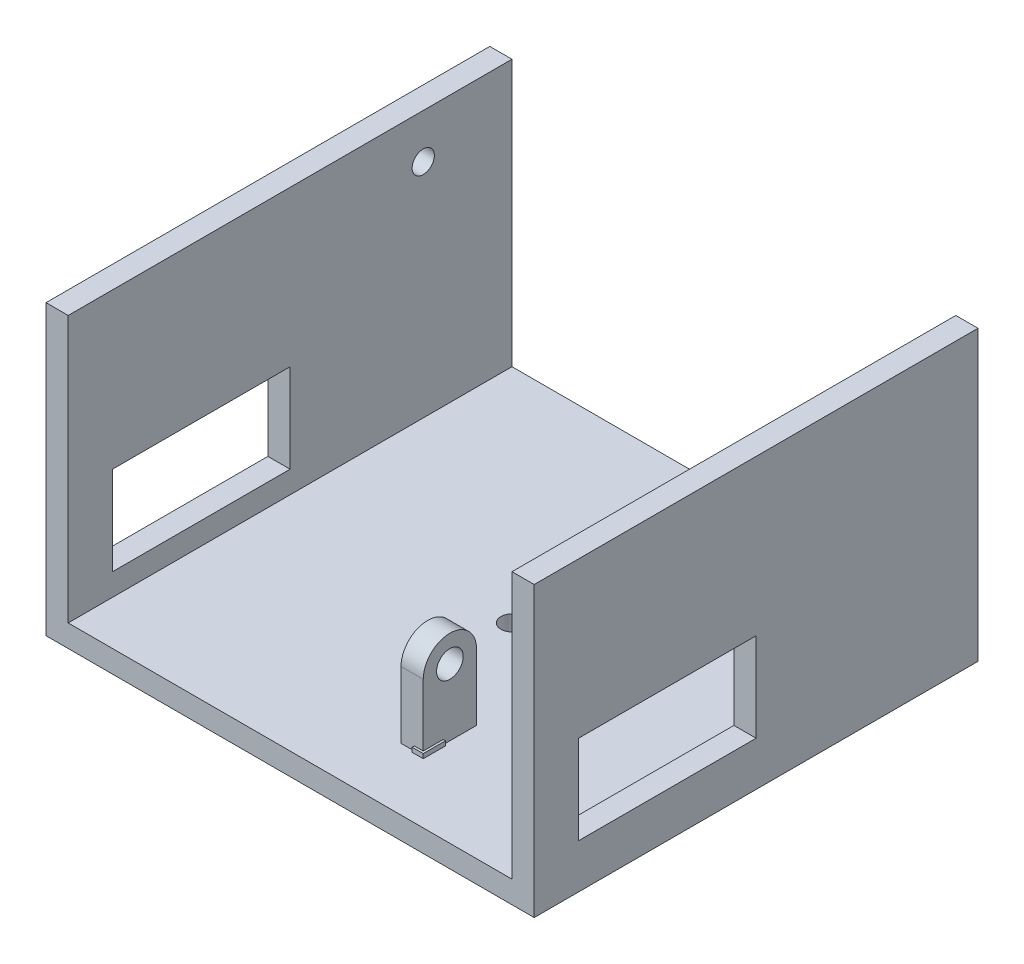
from build123d import *

# Parameters (mm, degrees)
BOSS_EXTRUDE2_DEPTH = 100
SKETCH2_R           = 2.5
SKETCH2_R_2         = 3
CUT_EXTRUDE1_DEPTH  = 10
SKETCH3_R           = 2.5
CUT_EXTRUDE2_DEPTH  = 10
SKETCH4_R           = 2
CUT_EXTRUDE3_DEPTH  = 10
SKETCH5_W           = 40
SKETCH5_H           = 20
CUT_EXTRUDE4_DEPTH  = 163.249807396
SKETCH6_W           = 5
SKETCH6_H           = 12
BOSS_EXTRUDE3_DEPTH = 15
BOSS_EXTRUDE4_DEPTH = 5
SKETCH9_R           = 3
CUT_EXTRUDE5_DEPTH  = 7
BOSS_EXTRUDE5_DEPTH = 1


with BuildPart() as part:
    # Sketch1 → Boss-Extrude2 (new body)
    with BuildSketch(Plane.XY):
        Polygon((-50, 5), (50, 5), (50, 65), (55, 65), (55, 0), (-55, 0), (-55, 65), (-50, 65), align=None)
    extrude(amount=BOSS_EXTRUDE2_DEPTH)

    # Sketch2 → Cut-Extrude1 (cut)
    with BuildSketch(Plane(origin=(0, 5, 0), x_dir=(1, 0, 0), z_dir=(0, 1, 0))):
        with Locations(Location((0, -50, 0), (0, 0, 270))):
            Circle(SKETCH2_R)
        with Locations(Location((0, -30, 0), (0, 0, 180))):
            Circle(SKETCH2_R_2)
    extrude(amount=-CUT_EXTRUDE1_DEPTH, mode=Mode.SUBTRACT)

    # Sketch3 → Cut-Extrude2 (cut)
    with BuildSketch(Plane.ZY.offset(55)):
        with Locations((80, 20)):
            Circle(SKETCH3_R)
        with Locations((20, 55)):
            Circle(SKETCH3_R)
    extrude(amount=-CUT_EXTRUDE2_DEPTH, mode=Mode.SUBTRACT)

    # Sketch4 → Cut-Extrude3 (cut)
    with BuildSketch(Plane(origin=(55, 0, 0), x_dir=(0, 0, -1), z_dir=(1, 0, 0))):
        with Locations((-80, 15)):
            Circle(SKETCH4_R)
    extrude(amount=-CUT_EXTRUDE3_DEPTH, mode=Mode.SUBTRACT)

    # Sketch5 → Cut-Extrude4 (cut, through all)
    with BuildSketch(Plane.ZY.offset(55)):
        with Locations((70, 20)):
            Rectangle(SKETCH5_W, SKETCH5_H)
    extrude(amount=-CUT_EXTRUDE4_DEPTH, mode=Mode.SUBTRACT)

    # Sketch6 → Boss-Extrude3 (add)
    with BuildSketch(Plane(origin=(0, 5, 0), x_dir=(1, 0, 0), z_dir=(0, 1, 0))):
        with Locations((13.5, -80)):
            Rectangle(SKETCH6_W, SKETCH6_H)
    extrude(amount=BOSS_EXTRUDE3_DEPTH)

    # Sketch8 → Boss-Extrude4 (add)
    with BuildSketch(Plane.ZY.offset(-11)):
        with BuildLine():
            Line((74, 20), (86, 20))
            ThreePointArc((86, 20), (80, 26), (74, 20))
        make_face()
    extrude(amount=-BOSS_EXTRUDE4_DEPTH)

    # Sketch9 → Cut-Extrude5 (cut)
    with BuildSketch(Plane.ZY.offset(-11)):
        with Locations((80, 20)):
            Circle(SKETCH9_R)
    extrude(amount=-CUT_EXTRUDE5_DEPTH, mode=Mode.SUBTRACT)

    # Sketch10 → Boss-Extrude5 (add)
    with BuildSketch(Plane(origin=(0, 5, 0), x_dir=(1, 0, 0), z_dir=(0, 1, 0))):
        Polygon((14, -86.5), (16.5, -86.5), (16.5, -81.5), (16, -81.5), (16, -86), (14, -86), align=None)
    extrude(amount=BOSS_EXTRUDE5_DEPTH)


solid = part.part
